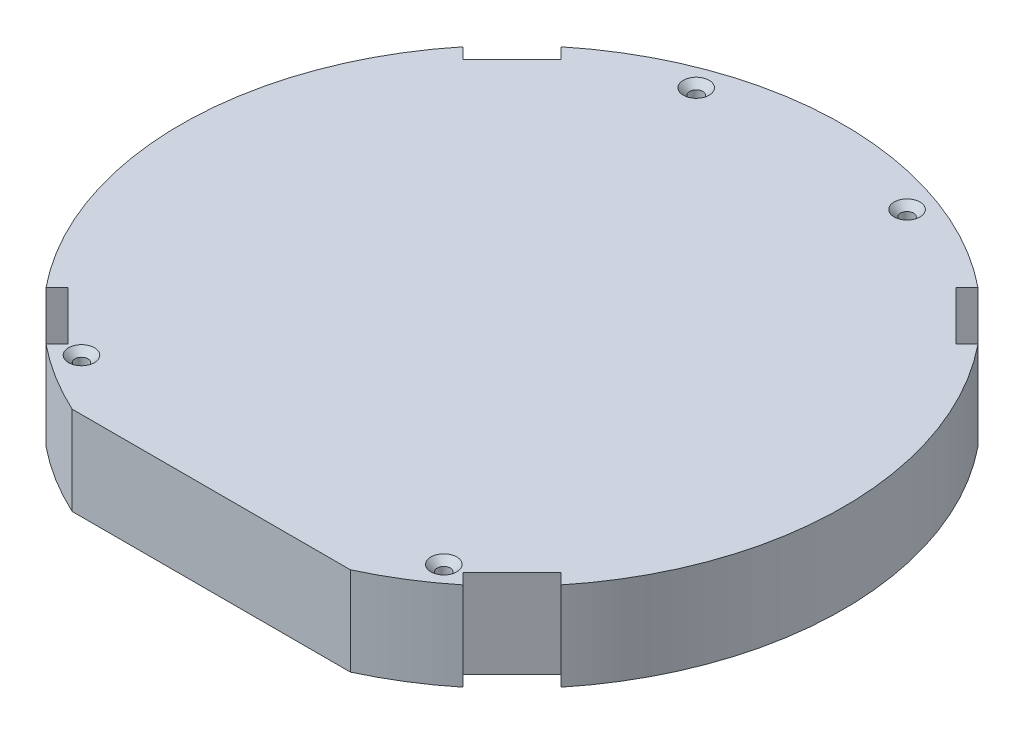
from build123d import *

# Parameters (mm, degrees)
RESSALTO_EXTRUS_O1_DEPTH             = 23
ESCAREADO_PARA_SFHCS_M31_D           = 3.4
ESCAREADO_PARA_SFHCS_M31_CSINK_D     = 6.72
ESCAREADO_PARA_SFHCS_M31_CSINK_ANGLE = 90
CORTE_EXTRUS_O1_DEPTH                = 124.778027129


with BuildPart() as part:
    # Esboço1 → Ressalto-extrusão1 (new body)
    with BuildSketch(Plane(origin=(0, 0, 0), x_dir=(1, 0, 0), z_dir=(0, 1, 0))):
        with BuildLine():
            Line((36.1, -78.056325817), (-36.1, -78.056325817))
            ThreePointArc((-36.1, -78.056325817), (-45.453875584, -73.006473647), (-54.113307426, -66.841229488))
            Line((-54.113307426, -66.841229488), (-66.841229488, -54.113307426))
            ThreePointArc((-66.841229488, -54.113307426), (-86, 0), (-66.841229488, 54.113307426))
            Line((-66.841229488, 54.113307426), (-54.113307426, 66.841229488))
            ThreePointArc((-54.113307426, 66.841229488), (0, 86), (54.113307426, 66.841229488))
            Line((54.113307426, 66.841229488), (66.841229488, 54.113307426))
            ThreePointArc((66.841229488, 54.113307426), (86, 0), (66.841229488, -54.113307426))
            Line((66.841229488, -54.113307426), (54.113307426, -66.841229488))
            ThreePointArc((54.113307426, -66.841229488), (45.453875584, -73.006473647), (36.1, -78.056325817))
        make_face()
    extrude(amount=RESSALTO_EXTRUS_O1_DEPTH)

    # Escareado para SFHCS M31 (through all)
    with Locations(Plane(origin=(0, 23, 0), x_dir=(1, 0, 0), z_dir=(0, 1, 0))):
        with Locations((47.022820183, -64.72135955), (27.361611466, 75.175409663), (-47.022820183, -64.72135955), (-27.361611466, 75.175409663)):
            CounterSinkHole(ESCAREADO_PARA_SFHCS_M31_D / 2, ESCAREADO_PARA_SFHCS_M31_CSINK_D / 2, counter_sink_angle=ESCAREADO_PARA_SFHCS_M31_CSINK_ANGLE)

    # Esboço6 → Corte-extrusão1 (cut, through all)
    with BuildSketch(Plane(origin=(0, 23, 0), x_dir=(1, 0, 0), z_dir=(0, 1, 0))):
        Polygon((-66.841229488, -54.113307426), (-64.012802363, -51.284880301), (-51.284880301, -64.012802363), (-54.113307426, -66.841229488), align=None)
        Polygon((-66.841229488, 54.113307426), (-64.012802363, 51.284880301), (-51.284880301, 64.012802363), (-54.113307426, 66.841229488), align=None)
        Polygon((66.841229488, -54.113307426), (64.012802363, -51.284880301), (51.284880301, -64.012802363), (54.113307426, -66.841229488), align=None)
        Polygon((66.841229488, 54.113307426), (54.113307426, 66.841229488), (51.284880301, 64.012802363), (64.012802363, 51.284880301), align=None)
    extrude(amount=-CORTE_EXTRUS_O1_DEPTH, mode=Mode.SUBTRACT)


solid = part.part
